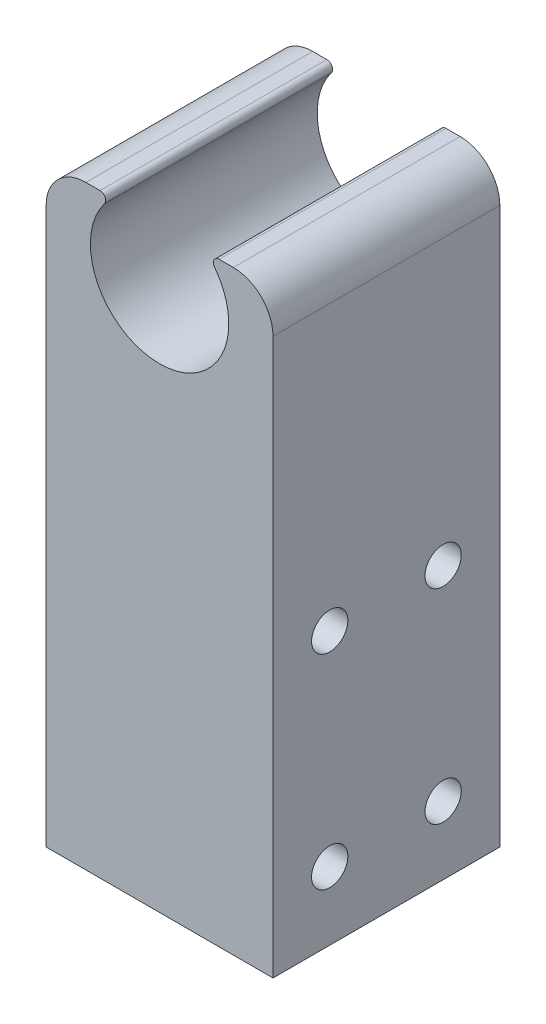
from build123d import *

# Parameters (mm, degrees)
EXTRUDE_1_DEPTH     = 20
SKETCH_2_R          = 1.6
CUT_EXTRUDE_1_DEPTH = 60.634302209
FILLET_1_R          = 3.5
FILLET_2_R          = 0.5


with BuildPart() as part:
    # 草图1 → 凸台-拉伸1 (new body)
    with BuildSketch(Plane.XY):
        with BuildLine():
            Line((0, 0), (20, 0))
            Line((20, 0), (20, 30))
            Line((20, 30), (20, 52.5))
            Line((20, 52.5), (14.118252056, 52.5))
            ThreePointArc((14.118252056, 52.5), (10, 41.9), (5.881747944, 52.5))
            Line((5.881747944, 52.5), (0, 52.5))
            Line((0, 52.5), (0, 30))
            Line((0, 30), (0, 0))
        make_face()
    extrude(amount=EXTRUDE_1_DEPTH)

    # 草图2 → 切除-拉伸1 (cut, through all)
    with BuildSketch(Plane(origin=(20, 0, 0), x_dir=(0, 0, -1), z_dir=(1, 0, 0))):
        with Locations((-15, 24)):
            Circle(SKETCH_2_R)
        with Locations(Location((-15, 6, 0), (0, 0, 180))):
            Circle(SKETCH_2_R)
        with Locations((-5, 6)):
            Circle(SKETCH_2_R)
        with Locations(Location((-5, 24, 0), (0, 0, 180))):
            Circle(SKETCH_2_R)
    extrude(amount=-CUT_EXTRUDE_1_DEPTH, mode=Mode.SUBTRACT)

    # 圆角1
    fillet_1_edges = [part.edges().sort_by_distance(p)[0] for p in [
        (0, 52.5, 10),
        (20, 52.5, 10),
    ]]
    fillet(fillet_1_edges, radius=FILLET_1_R)

    # 圆角2
    fillet_2_edges = [part.edges().sort_by_distance(p)[0] for p in [
        (5.881747944, 52.5, 10),
        (14.118252056, 52.5, 10),
    ]]
    fillet(fillet_2_edges, radius=FILLET_2_R)


solid = part.part
